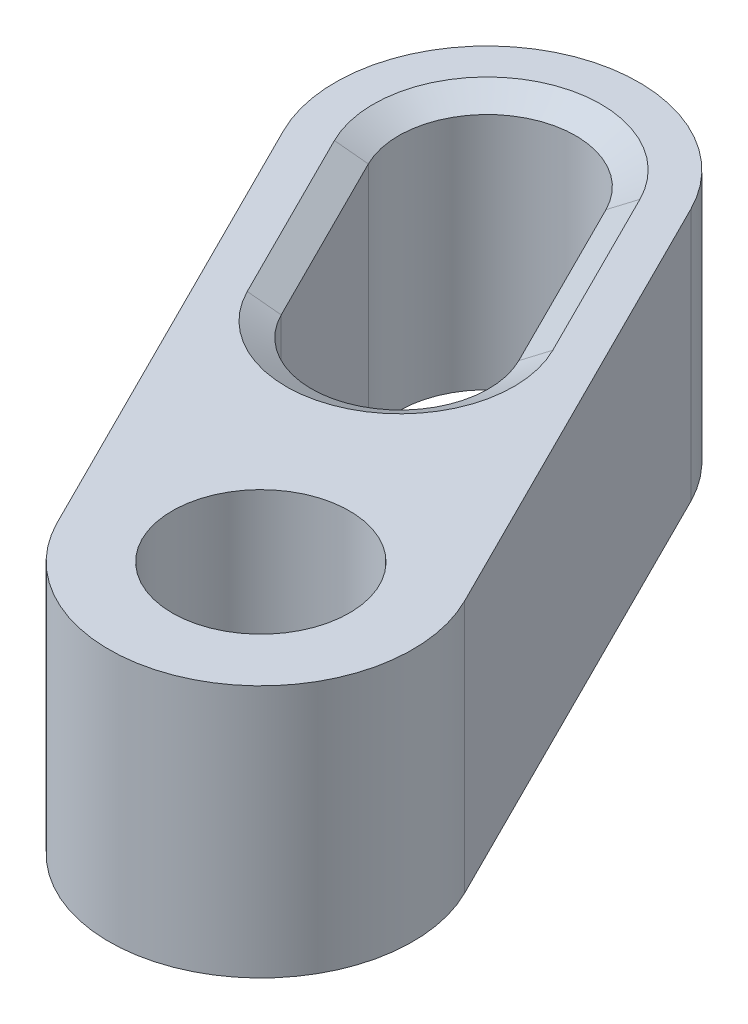
from build123d import *

# Parameters (mm, degrees)
SKETCH1_R           = 1.75
BOSS_EXTRUDE1_DEPTH = 5
CHAMFER1_SIZE       = 0.5
CHAMFER1_SIZE2      = 0.288675135


with BuildPart() as part:
    # Sketch1 → Boss-Extrude1 (new body)
    with BuildSketch(Plane(origin=(0, 0, 0), x_dir=(1, 0, 0), z_dir=(0, 1, 0))):
        with BuildLine():
            Line((15.433281573, 35.541640786), (10.961145618, 44.485912696))
            ThreePointArc((10.961145618, 44.485912696), (6.936223259, 45.827553483), (5.594582472, 41.802631123))
            Line((5.594582472, 41.802631123), (10.066718427, 32.858359214))
            ThreePointArc((10.066718427, 32.858359214), (14.091640786, 31.516718427), (15.433281573, 35.541640786))
        make_face()
        with Locations(Location((12.75, 34.2, 0), (0, 0, 270))):
            Circle(SKETCH1_R, mode=Mode.SUBTRACT)
        with BuildLine():
            Line((11.565247584, 40.482623792), (9.843111629, 43.926895702))
            ThreePointArc((9.843111629, 43.926895702), (7.495240253, 44.709519494), (6.712616461, 42.361648118))
            Line((6.712616461, 42.361648118), (8.434752416, 38.917376208))
            ThreePointArc((8.434752416, 38.917376208), (10.782623792, 38.134752416), (11.565247584, 40.482623792))
        make_face(mode=Mode.SUBTRACT)
    extrude(amount=BOSS_EXTRUDE1_DEPTH)

    # Chamfer1
    chamfer1_edges = [part.edges().sort_by_distance(p)[0] for p in [
        (10.782623792, 5, -38.134752416),
        (10.704179607, 5, -42.204759747),
        (7.495240253, 5, -44.709519494),
        (7.573684438, 5, -40.639512163),
    ]]
    chamfer1_side = [part.faces().sort_by_distance(p)[0] for p in [
        (7.993867335, 5, -37.412103611),
    ]]
    chamfer(chamfer1_edges, length=CHAMFER1_SIZE, length2=CHAMFER1_SIZE2, reference=chamfer1_side[0])


solid = part.part
